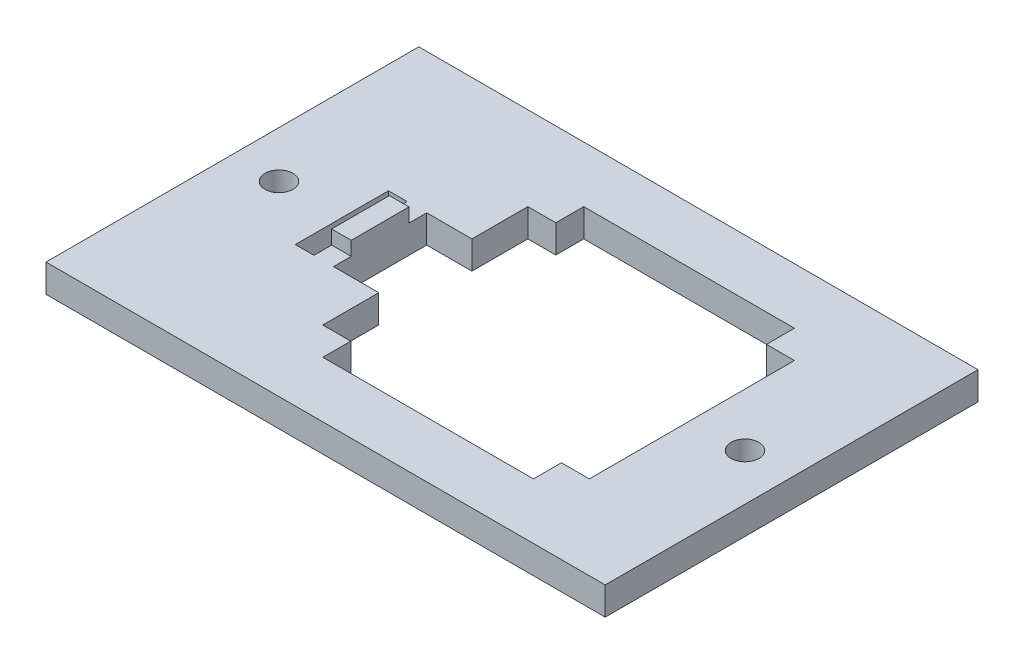
from build123d import *

# Parameters (mm, degrees)
SKETCH1_W           = 60
SKETCH1_H           = 40
MAINBODY_DEPTH      = 3
CUT_EXTRUDE1_REACH  = 38.18
SKETCH2_W           = 28.6
SKETCH2_H           = 28
CUT_EXTRUDE2_REACH  = 38.18
SKETCH7_R           = 1.5
SKETCH8_W           = 3
SKETCH8_H           = 3
BOSS_EXTRUDE2_DEPTH = 3
CUT_EXTRUDE3_REACH  = 38.18
SKETCH9_W           = 4.85
SKETCH9_H           = 10
SKETCH9_W_2         = 2
SKETCH10_W          = 2.1
SKETCH10_H          = 6.2
BOSS_EXTRUDE3_DEPTH = 1.5


with BuildPart() as part:
    # Sketch1 → MainBody (new body)
    with BuildSketch(Plane(origin=(0, 0, 0), x_dir=(1, 0, 0), z_dir=(0, 1, 0))):
        Rectangle(SKETCH1_W, SKETCH1_H)
    extrude(amount=MAINBODY_DEPTH)

    # Sketch2 → Cut-Extrude1 (cut, up to next)
    with BuildSketch(Plane(origin=(0, 3, 0), x_dir=(1, 0, 0), z_dir=(0, 1, 0)), mode=Mode.PRIVATE) as cut_extrude1_sk1:
        with Locations((5, 0)):
            Rectangle(SKETCH2_W, SKETCH2_H)
    cut_extrude1_tool1 = extrude(cut_extrude1_sk1.sketch, amount=-CUT_EXTRUDE1_REACH, mode=Mode.PRIVATE) & part.part
    add(cut_extrude1_tool1.solids().sort_by_distance((5, 3, 0))[0], mode=Mode.SUBTRACT)

    # Sketch7 → Cut-Extrude2 (cut, up to next)
    with BuildSketch(Plane(origin=(0, 3, 0), x_dir=(1, 0, 0), z_dir=(0, 1, 0)), mode=Mode.PRIVATE) as cut_extrude2_sk1:
        with Locations(Location((25, 0, 0), (0, 0, 270))):
            Circle(SKETCH7_R)
    cut_extrude2_tool1 = extrude(cut_extrude2_sk1.sketch, amount=-CUT_EXTRUDE2_REACH, mode=Mode.PRIVATE) & part.part
    # Sketch7 → Cut-Extrude2 (cut, up to next)
    with BuildSketch(Plane(origin=(0, 3, 0), x_dir=(1, 0, 0), z_dir=(0, 1, 0)), mode=Mode.PRIVATE) as cut_extrude2_sk2:
        with Locations(Location((-25, 0, 0), (0, 0, 270))):
            Circle(SKETCH7_R)
    cut_extrude2_tool2 = extrude(cut_extrude2_sk2.sketch, amount=-CUT_EXTRUDE2_REACH, mode=Mode.PRIVATE) & part.part
    add(cut_extrude2_tool1.solids().sort_by_distance((25, 3, 0))[0], mode=Mode.SUBTRACT)
    add(cut_extrude2_tool2.solids().sort_by_distance((-25, 3, 0))[0], mode=Mode.SUBTRACT)

    # Sketch8 → Boss-Extrude2 (add)
    with BuildSketch(Plane(origin=(0, 3, 0), x_dir=(1, 0, 0), z_dir=(0, 1, 0))):
        with Locations((-7.8, 12.5)):
            Rectangle(SKETCH8_W, SKETCH8_H)
        with Locations((-7.8, -12.5)):
            Rectangle(SKETCH8_W, SKETCH8_H)
        with Locations((17.8, -12.5)):
            Rectangle(SKETCH8_W, SKETCH8_H)
        with Locations((17.8, 12.5)):
            Rectangle(SKETCH8_W, SKETCH8_H)
    extrude(amount=-BOSS_EXTRUDE2_DEPTH)

    # Sketch9 → Cut-Extrude3 (cut, up to next)
    with BuildSketch(Plane(origin=(0, 3, 0), x_dir=(1, 0, 0), z_dir=(0, 1, 0)), mode=Mode.PRIVATE) as cut_extrude3_sk1:
        with Locations((-11.725, 0)):
            Rectangle(SKETCH9_W, SKETCH9_H)
    cut_extrude3_tool1 = extrude(cut_extrude3_sk1.sketch, amount=-CUT_EXTRUDE3_REACH, mode=Mode.PRIVATE) & part.part
    # Sketch9 → Cut-Extrude3 (cut, up to next)
    with BuildSketch(Plane(origin=(0, 3, 0), x_dir=(1, 0, 0), z_dir=(0, 1, 0)), mode=Mode.PRIVATE) as cut_extrude3_sk2:
        with Locations((-17.25, 0)):
            Rectangle(SKETCH9_W_2, SKETCH9_H)
    cut_extrude3_tool2 = extrude(cut_extrude3_sk2.sketch, amount=-CUT_EXTRUDE3_REACH, mode=Mode.PRIVATE) & part.part
    add(cut_extrude3_tool1.solids().sort_by_distance((-11.725, 3, 0))[0], mode=Mode.SUBTRACT)
    add(cut_extrude3_tool2.solids().sort_by_distance((-17.25, 3, 0))[0], mode=Mode.SUBTRACT)

    # Sketch10 → Boss-Extrude3 (add)
    with BuildSketch(Plane(origin=(0, 3, 0), x_dir=(1, 0, 0), z_dir=(0, 1, 0))):
        with Locations((-15.2, 0)):
            Rectangle(SKETCH10_W, SKETCH10_H)
    extrude(amount=BOSS_EXTRUDE3_DEPTH)


solid = part.part
